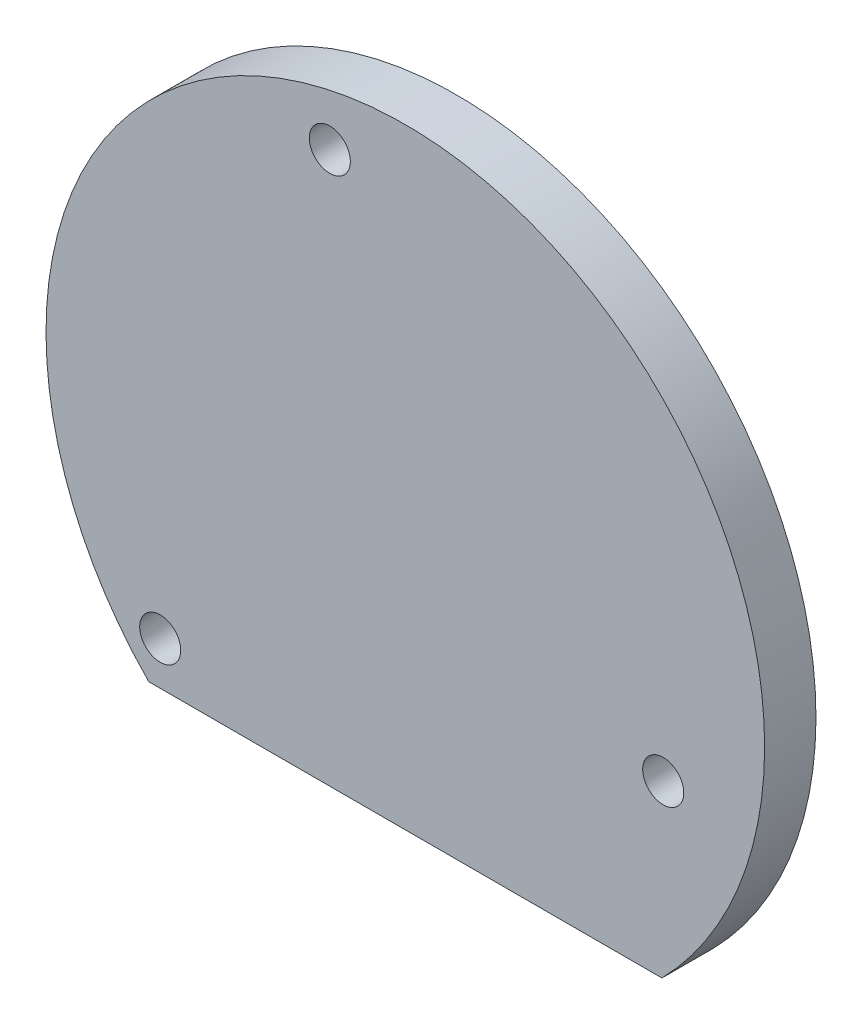
from build123d import *

# Parameters (mm, degrees)
SKETCH1_R           = 35.56
BOSS_EXTRUDE1_DEPTH = 5.08
CUT_EXTRUDE1_DEPTH  = 51.545361805
SKETCH7_R           = 2.032
CUT_EXTRUDE2_DEPTH  = 51.545361805


with BuildPart() as part:
    # Sketch1 → Boss-Extrude1 (new body)
    with BuildSketch(Plane.XY):
        Circle(SKETCH1_R)
    extrude(amount=BOSS_EXTRUDE1_DEPTH)

    # Sketch2 → Cut-Extrude1 (cut, through all)
    with BuildSketch(Plane.XY.offset(5.08)):
        Polygon((0, -35.56), (-36.256055522, -35.56), (-36.256055522, -24.892), (33.75035888, -24.892), (33.75035888, -35.56), align=None)
    extrude(amount=-CUT_EXTRUDE1_DEPTH, mode=Mode.SUBTRACT)

    # Sketch7 → Cut-Extrude2 (cut, through all)
    with BuildSketch(Plane.XY.offset(5.08)):
        with Locations((-24.261099887, -20.626476503)):
            Circle(SKETCH7_R)
        with Locations((-7.471969114, 29.665523497)):
            Circle(SKETCH7_R)
        with Locations((25.522900113, -7.952823738)):
            Circle(SKETCH7_R)
    extrude(amount=-CUT_EXTRUDE2_DEPTH, mode=Mode.SUBTRACT)


solid = part.part
